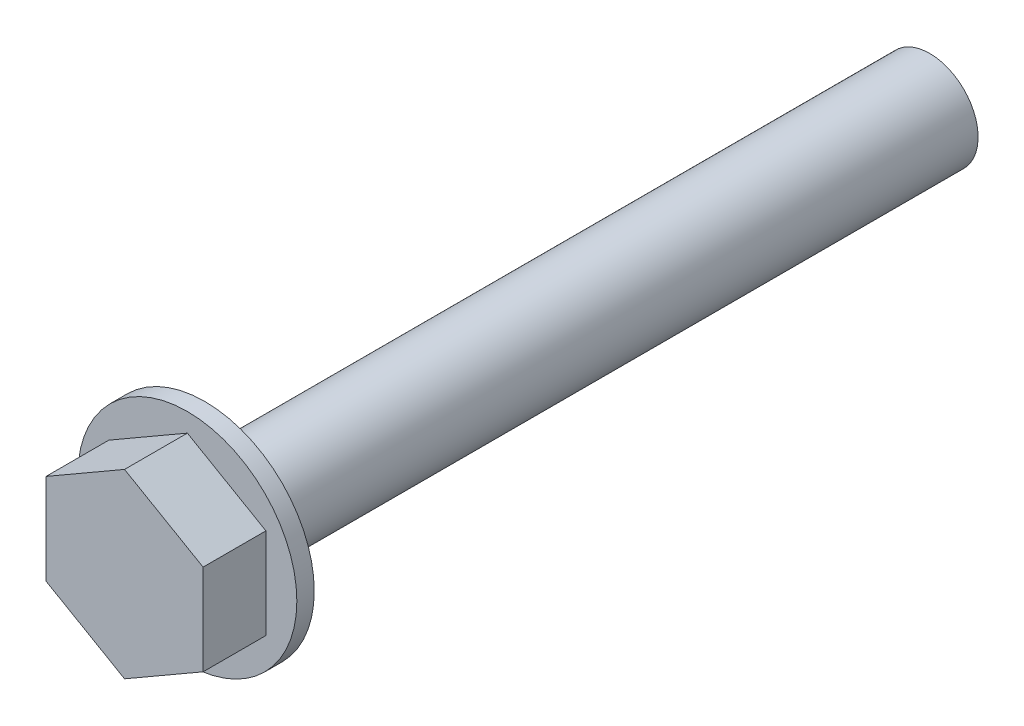
from build123d import *

# Parameters (mm, degrees)
EXTRUDE_SKETCH_1_R = 9.06
EXTRUDE_1_DEPTH    = 1.44
EXTRUDE_START      = 1.44
EXTRUDE_2_DEPTH    = 5.2
EXTRUDE_START_2    = -60
EXTRUDE_SKETCH_3_R = 4
EXTRUDE_3_DEPTH    = 60.01


with BuildPart() as part:
    # Extrude sketch 1 → Extrude 1 (new body)
    with BuildSketch(Plane.XY):
        Circle(EXTRUDE_SKETCH_1_R)
    extrude(amount=EXTRUDE_1_DEPTH)


with BuildPart() as body_2:
    # Extrude sketch 2 → Extrude 2 (new body)
    with BuildSketch(Plane.XY.offset(EXTRUDE_START)):
        Polygon((6.5, 3.75277675), (0, 7.505553499), (-6.5, 3.75277675), (-6.5, -3.75277675), (0, -7.505553499), (6.5, -3.75277675), align=None)
    extrude(amount=EXTRUDE_2_DEPTH)


with BuildPart() as body_3:
    # Extrude sketch 3 → Extrude 3 (new body)
    with BuildSketch(Plane.XY.offset(EXTRUDE_START_2)):
        Circle(EXTRUDE_SKETCH_3_R)
    extrude(amount=EXTRUDE_3_DEPTH)


with BuildPart() as body_2_1:
    add(body_2.part)

    # Combine (weld / assembly of features): union part, body 3
    add(part.part)
    add(body_3.part)


solid = body_2_1.part
